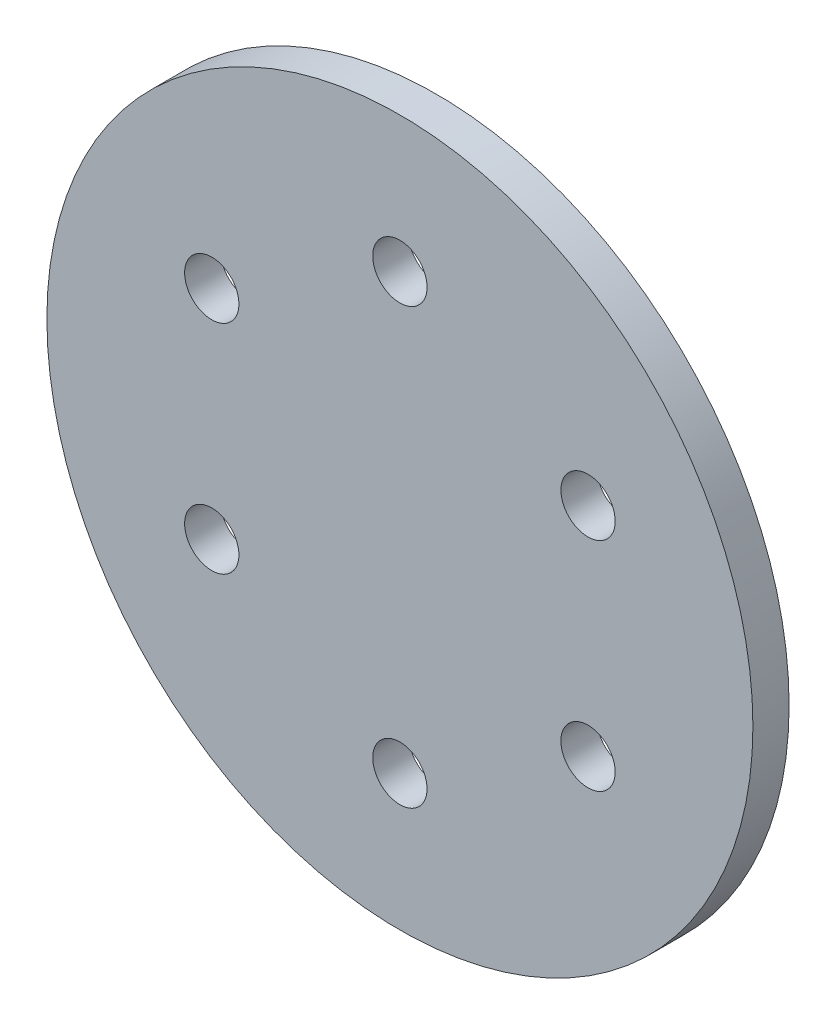
from build123d import *

# Parameters (mm, degrees)
SKETCH1_R           = 30.95625
SKETCH1_R_2         = 2.38125
BOSS_EXTRUDE1_DEPTH = 3.175


with BuildPart() as part:
    # Sketch1 → Boss-Extrude1 (new body)
    with BuildSketch(Plane.XY):
        Circle(SKETCH1_R)
        with Locations((0, 19.05)):
            Circle(SKETCH1_R_2, mode=Mode.SUBTRACT)
        with Locations((16.497783942, 9.525)):
            Circle(SKETCH1_R_2, mode=Mode.SUBTRACT)
        with Locations((16.497783942, -9.525)):
            Circle(SKETCH1_R_2, mode=Mode.SUBTRACT)
        with Locations((0, -19.05)):
            Circle(SKETCH1_R_2, mode=Mode.SUBTRACT)
        with Locations((-16.497783942, -9.525)):
            Circle(SKETCH1_R_2, mode=Mode.SUBTRACT)
        with Locations((-16.497783942, 9.525)):
            Circle(SKETCH1_R_2, mode=Mode.SUBTRACT)
    extrude(amount=BOSS_EXTRUDE1_DEPTH)


solid = part.part
